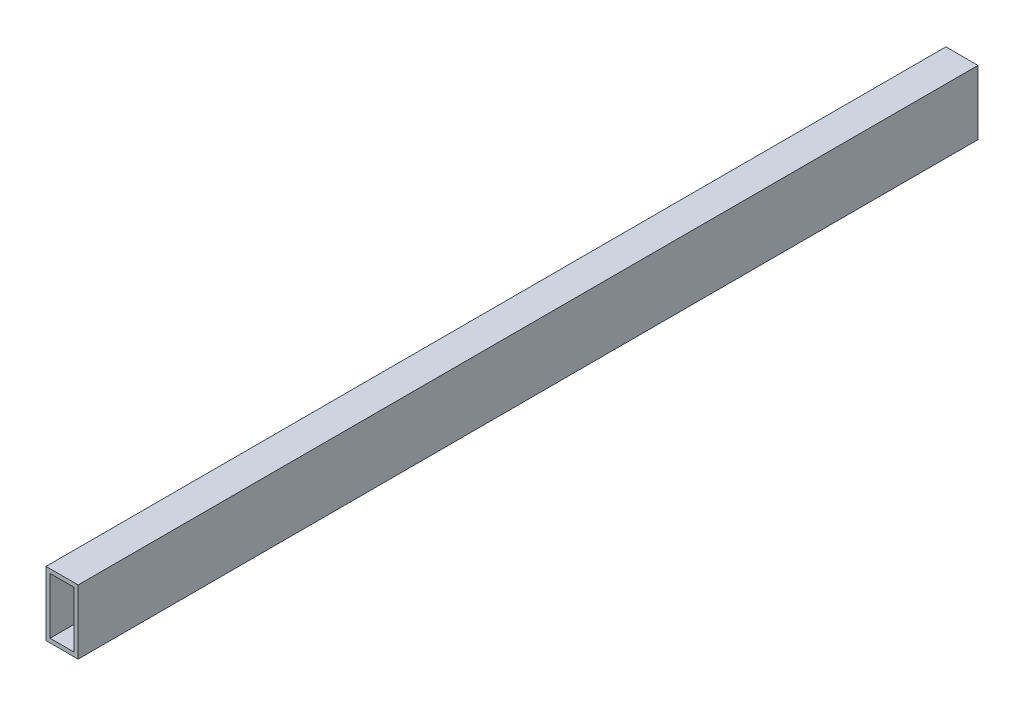
from build123d import *

# Parameters (mm, degrees)
SKETCH1_W           = 25.4
SKETCH1_H           = 50.8
SKETCH1_W_2         = 18.9992
SKETCH1_H_2         = 44.3992
BOSS_EXTRUDE1_DEPTH = 749.3
SKETCH2_W           = 25.4
SKETCH2_H           = 50.8
CUT_EXTRUDE1_DEPTH  = 393.7
SKETCH3_W           = 25.4
SKETCH3_H           = 50.8
CUT_EXTRUDE2_DEPTH  = 393.7


with BuildPart() as part:
    # Sketch1 → Boss-Extrude1 (new, symmetric)
    with BuildSketch(Plane.XY):
        Rectangle(SKETCH1_W, SKETCH1_H)
        Rectangle(SKETCH1_W_2, SKETCH1_H_2, mode=Mode.SUBTRACT)
    extrude(amount=BOSS_EXTRUDE1_DEPTH, both=True)

    # Sketch2 → Cut-Extrude1 (cut)
    with BuildSketch(Plane.XY.offset(749.3)):
        Rectangle(SKETCH2_W, SKETCH2_H)
    extrude(amount=-CUT_EXTRUDE1_DEPTH, mode=Mode.SUBTRACT)

    # Sketch3 → Cut-Extrude2 (cut)
    with BuildSketch(Plane(origin=(0, 0, -749.3), x_dir=(-1, 0, 0), z_dir=(0, 0, -1))):
        Rectangle(SKETCH3_W, SKETCH3_H)
    extrude(amount=-CUT_EXTRUDE2_DEPTH, mode=Mode.SUBTRACT)


solid = part.part
